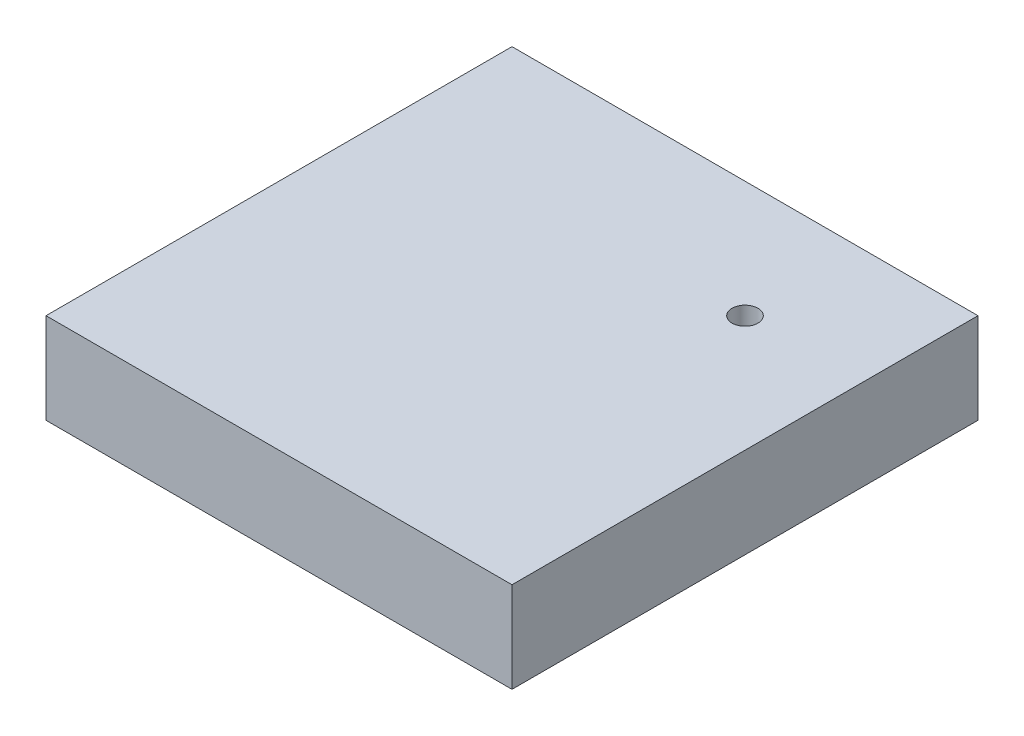
from build123d import *

# Parameters (mm, degrees)
SKETCH1_W                   = 114.3
SKETCH1_H                   = 114.3
BOSS_EXTRUDE1_DEPTH         = 22.225
F_1_4_0_25_DIAMETER_HOLE1_D = 6.35


with BuildPart() as part:
    # Sketch1 → Boss-Extrude1 (new body)
    with BuildSketch(Plane(origin=(0, 0, 0), x_dir=(1, 0, 0), z_dir=(0, 1, 0))):
        Rectangle(SKETCH1_W, SKETCH1_H)
    extrude(amount=BOSS_EXTRUDE1_DEPTH)

    # 1/4 (0.25) Diameter Hole1 (through all)
    with Locations(Plane(origin=(0, 22.225, 0), x_dir=(1, 0, 0), z_dir=(0, 1, 0))):
        with Locations((28.575, 28.575)):
            Hole(F_1_4_0_25_DIAMETER_HOLE1_D / 2)


solid = part.part
